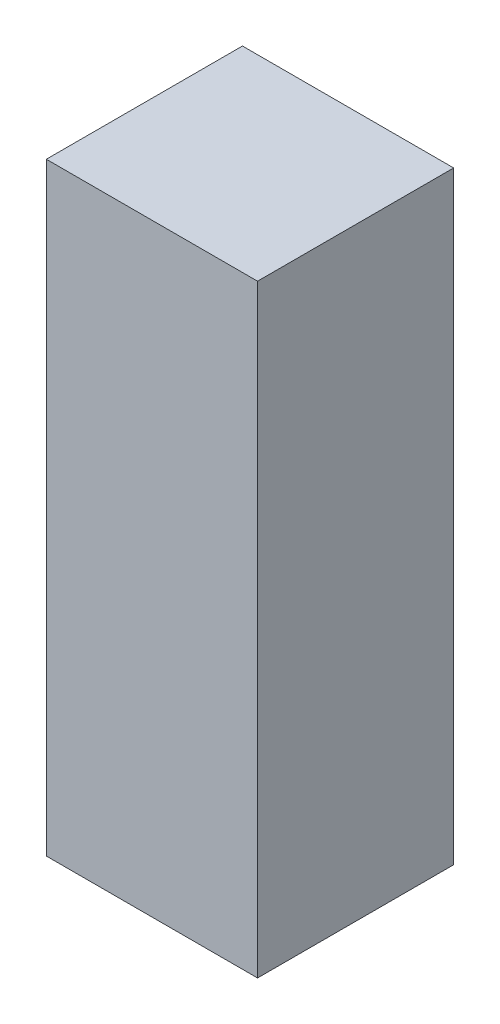
from build123d import *

# Parameters (mm, degrees)
OVEN_PANO_KAPAGI_MENTESE_1_1_START = 20
SKETCH1_W                          = 14
SKETCH1_H                          = 40
OVEN_PANO_KAPAGI_MENTESE_1_1_DEPTH = 13


with BuildPart() as part:
    # Sketch1 → OVEN_pano_kapagi_mentese_1_1 (new body)
    with BuildSketch(Plane.XY.offset(OVEN_PANO_KAPAGI_MENTESE_1_1_START)):
        with Locations((31, 180)):
            Rectangle(SKETCH1_W, SKETCH1_H)
    extrude(amount=OVEN_PANO_KAPAGI_MENTESE_1_1_DEPTH)


solid = part.part
